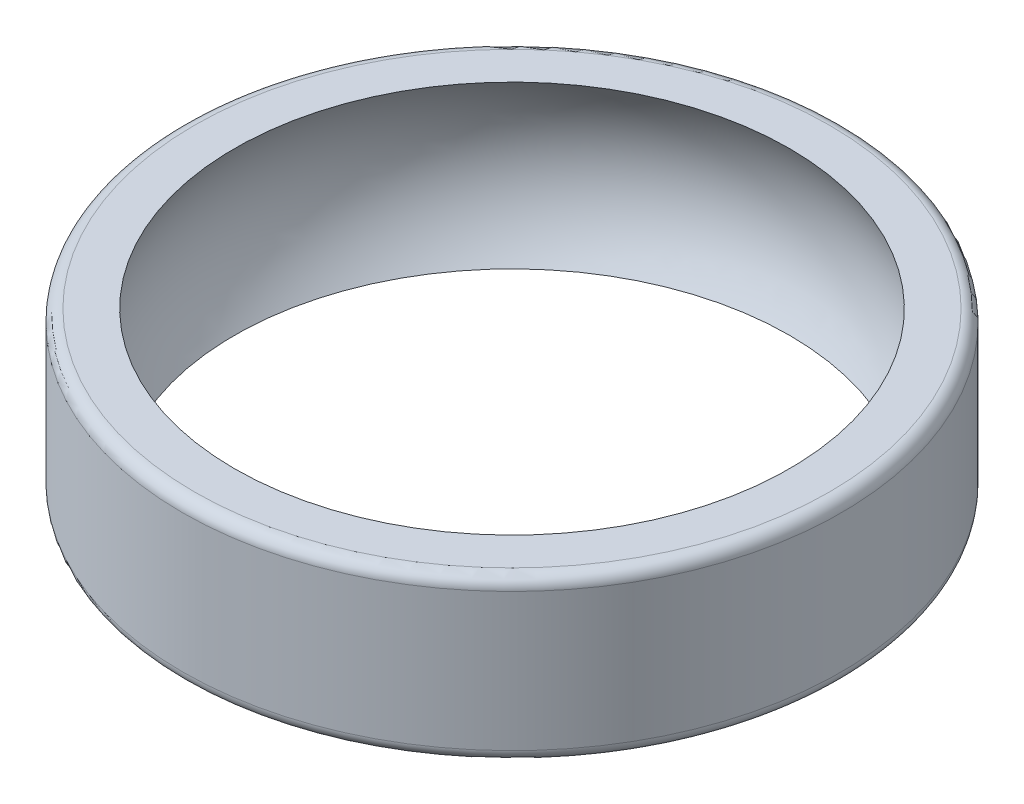
from build123d import *

# Parameters (mm, degrees)
SKETCH1_R           = 55
SKETCH1_R_2         = 46.3
BOSS_EXTRUDE1_DEPTH = 27
FILLET1_R           = 2


with BuildPart() as part:
    # Sketch1 → Boss-Extrude1 (new body)
    with BuildSketch(Plane(origin=(0, 0, 0), x_dir=(1, 0, 0), z_dir=(0, 1, 0))):
        with Locations(Location((0, 0, 0), (0, 0, 270))):
            Circle(SKETCH1_R)
        with Locations(Location((0, 0, 0), (0, 0, 270))):
            Circle(SKETCH1_R_2, mode=Mode.SUBTRACT)
    extrude(amount=BOSS_EXTRUDE1_DEPTH)

    # Fillet1
    fillet1_edges = [part.edges().sort_by_distance(p)[0] for p in [
        (0, 0, -55),
        (0, 27, -55),
    ]]
    fillet(fillet1_edges, radius=FILLET1_R)

    # Sketch2 → Cut-Revolve1 (revolve, cut)
    with BuildSketch(Plane.XY):
        with BuildLine():
            Line((-46.3, 27), (-46.3, 0))
            add(Edge.make_bspline(
                [(-46.3, 27), (-55.638814742, 13.5), (-46.3, 0)],
                knots=[0, 0, 0, 1, 1, 1], degree=2))
        make_face()
    revolve(axis=Axis((0, 0, 0), (0, 1, 0)), mode=Mode.SUBTRACT)


solid = part.part
